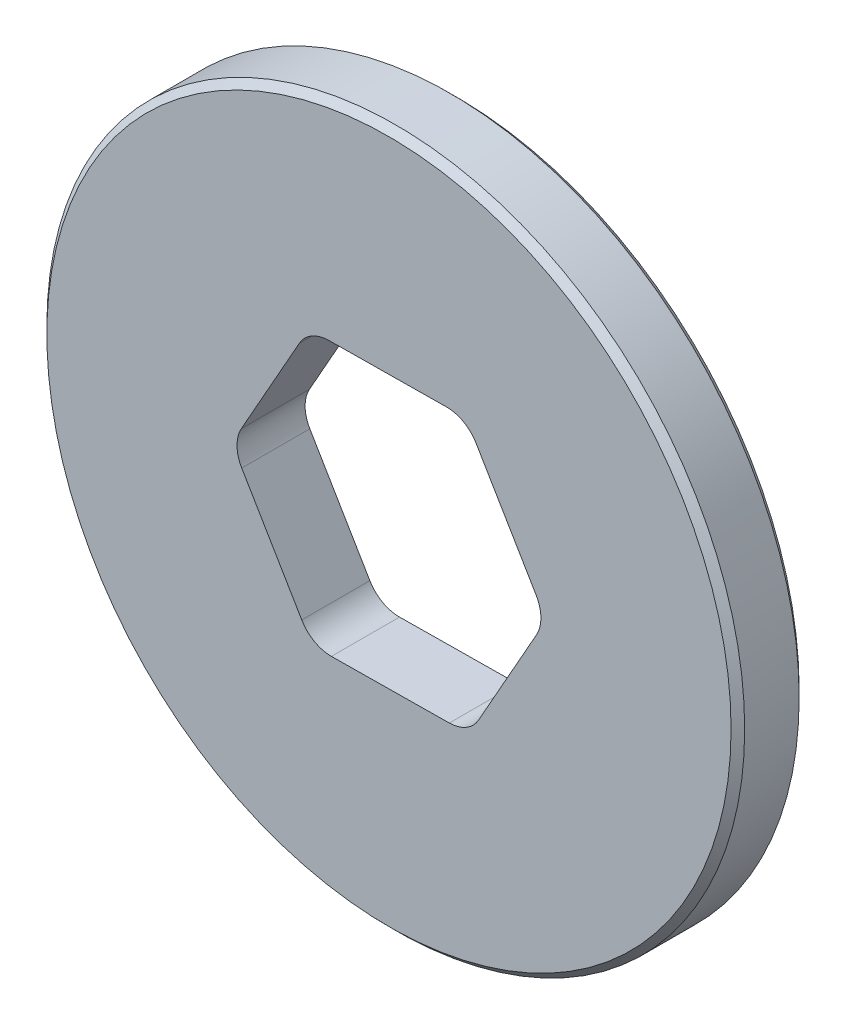
from build123d import *

# Parameters (mm, degrees)
SKETCH1_R           = 102.5
BOSS_EXTRUDE1_DEPTH = 20
FILLET1_R           = 10
CHAMFER1_SIZE       = 2


with BuildPart() as part:
    # Sketch1 → Boss-Extrude1 (new body)
    with BuildSketch(Plane.XY):
        Circle(SKETCH1_R)
        Polygon((23.510405521, -39.756687055), (46.18550372, 0.482264907), (22.6750982, 40.238951962), (-23.510405521, 39.756687055), (-46.18550372, -0.482264907), (-22.6750982, -40.238951962), align=None, mode=Mode.SUBTRACT)
    extrude(amount=BOSS_EXTRUDE1_DEPTH)

    # Fillet1
    fillet1_edges = [part.edges().sort_by_distance(p)[0] for p in [
        (23.510405521, -39.756687055, 10),
        (46.18550372, 0.482264907, 10),
        (22.6750982, 40.238951962, 10),
        (-23.510405521, 39.756687055, 10),
        (-46.18550372, -0.482264907, 10),
        (-22.6750982, -40.238951962, 10),
    ]]
    fillet(fillet1_edges, radius=FILLET1_R)

    # Chamfer1
    chamfer1_edges = [part.edges().sort_by_distance(p)[0] for p in [
        (-102.5, 0, 0),
        (-102.5, 0, 20),
    ]]
    chamfer(chamfer1_edges, length=CHAMFER1_SIZE)


solid = part.part
